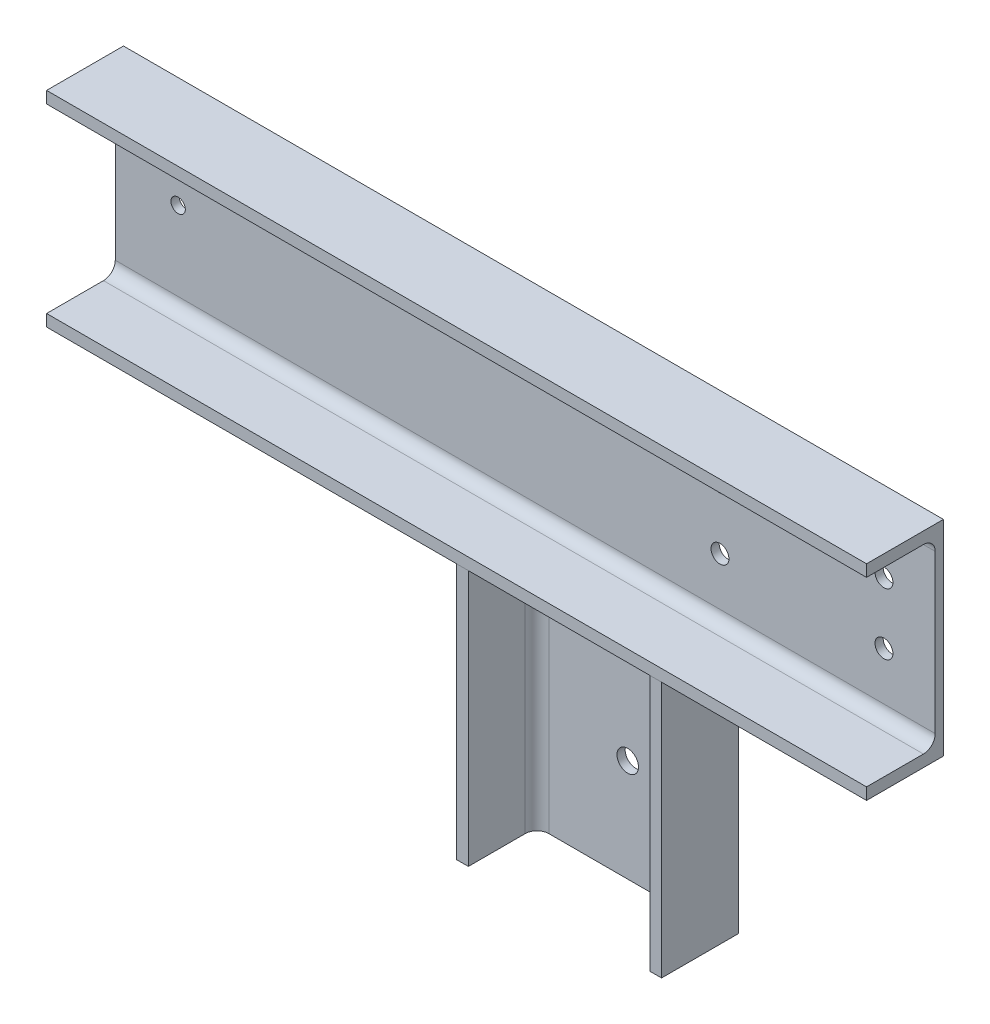
from build123d import *

# Parameters (mm, degrees)
SQUARE_HSS_AL_CS_CHANNEL_SQR_END_4_X_2_0_DEPTH = 800
SQUARE_HSS_AL_CS_CHANNEL_SQR_END_4_X_2_DEPTH   = 250
SKETCH15_W                                     = 10.5
SKETCH15_H                                     = 8
SKETCH22_W                                     = 7
SKETCH22_H                                     = 8
M20X2_5_TAPPED_HOLE1_AT_2_COUNT                = 2
M20X2_5_TAPPED_HOLE1_AT_2_PITCH                = 160
M20X2_5_TAPPED_HOLE1_AT_3_COUNT                = 2
M20X2_5_TAPPED_HOLE1_AT_3_PITCH                = 170.880074906
M20X2_5_TAPPED_HOLE1_AT_4_COUNT                = 2
M20X2_5_TAPPED_HOLE1_AT_4_PITCH                = 60


with BuildPart() as part:
    # Sketch11 → Square hss AL CS CHANNEL SQR END 4 X 2.0 (new body)
    with BuildSketch(Plane.ZY.offset(-400)):
        with BuildLine():
            Line((0, 0), (0, 200))
            Line((0, 200), (75, 200))
            Line((75, 200), (75, 188.5))
            Line((75, 188.5), (19.5, 188.5))
            ThreePointArc((19.5, 188.5), (11.368272016, 185.131727984), (8, 177))
            Line((8, 177), (8, 23))
            ThreePointArc((8, 23), (11.368272016, 14.868272016), (19.5, 11.5))
            Line((19.5, 11.5), (75, 11.5))
            Line((75, 11.5), (75, 0))
            Line((75, 0), (0, 0))
        make_face()
    extrude(amount=SQUARE_HSS_AL_CS_CHANNEL_SQR_END_4_X_2_0_DEPTH)

    # Sketch22 → M20x2.0 Tapped Hole1 (revolve, cut)
    with BuildSketch(Plane(origin=(-338.671963182, 100, 8), x_dir=(0, -1, 0), z_dir=(1, 0, 0))):
        with Locations((3.5, 4)):
            Rectangle(SKETCH22_W, SKETCH22_H)
    revolve(axis=Axis((-338.671963182, 100, 14.35), (0, 0, -1)), mode=Mode.SUBTRACT)

    # Sketch26 → M20x2.5 Tapped Hole1 (revolve, cut)
    with BuildSketch(Plane(origin=(190, 130, 8), x_dir=(0, -1, 0), z_dir=(1, 0, 0))):
        Polygon((0, 0), (0, 52.757530416), (8.75, 47.5), (8.75, 0), align=None)
    m20x2_5_tapped_hole1 = revolve(axis=Axis((190, 130, 14.35), (0, 0, -1)), mode=Mode.SUBTRACT)

    # M20x2.5 Tapped Hole1 at 2: M20x2.5 Tapped Hole1 ×2
    with Locations(*[(i * M20X2_5_TAPPED_HOLE1_AT_2_PITCH, 0, 0) for i in range(1, M20X2_5_TAPPED_HOLE1_AT_2_COUNT)]):
        add(m20x2_5_tapped_hole1, mode=Mode.SUBTRACT)

    # M20x2.5 Tapped Hole1 at 3: M20x2.5 Tapped Hole1 ×2
    with Locations(*[Vector(0.9363291775690448, -0.35112344158839115, 0) * (i * M20X2_5_TAPPED_HOLE1_AT_3_PITCH) for i in range(1, M20X2_5_TAPPED_HOLE1_AT_3_COUNT)]):
        add(m20x2_5_tapped_hole1, mode=Mode.SUBTRACT)

    # M20x2.5 Tapped Hole1 at 4: M20x2.5 Tapped Hole1 ×2
    with Locations(*[(0, -i * M20X2_5_TAPPED_HOLE1_AT_4_PITCH, 0) for i in range(1, M20X2_5_TAPPED_HOLE1_AT_4_COUNT)]):
        add(m20x2_5_tapped_hole1, mode=Mode.SUBTRACT)


with BuildPart() as body_2:
    # Sketch12 → Square hss AL CS CHANNEL SQR END 4 X 2 (new body)
    with BuildSketch(Plane(origin=(200, 0, 0), x_dir=(0, 0, 1), z_dir=(0, -1, 0))):
        with BuildLine():
            Line((0, 0), (0, 200))
            Line((0, 200), (75, 200))
            Line((75, 200), (75, 188.5))
            Line((75, 188.5), (19.5, 188.5))
            ThreePointArc((19.5, 188.5), (11.368272016, 185.131727984), (8, 177))
            Line((8, 177), (8, 23))
            ThreePointArc((8, 23), (11.368272016, 14.868272016), (19.5, 11.5))
            Line((19.5, 11.5), (75, 11.5))
            Line((75, 11.5), (75, 0))
            Line((75, 0), (0, 0))
        make_face()
    extrude(amount=SQUARE_HSS_AL_CS_CHANNEL_SQR_END_4_X_2_DEPTH)

    # Sketch15 → M24x3.0 Tapped Hole1 (revolve, cut)
    with BuildSketch(Plane(origin=(100, -150, 8), x_dir=(0, -1, 0), z_dir=(1, 0, 0))):
        with Locations((5.25, 4)):
            Rectangle(SKETCH15_W, SKETCH15_H)
    revolve(axis=Axis((100, -150, 14.35), (0, 0, -1)), mode=Mode.SUBTRACT)


solid = Compound([part.part, body_2.part])
